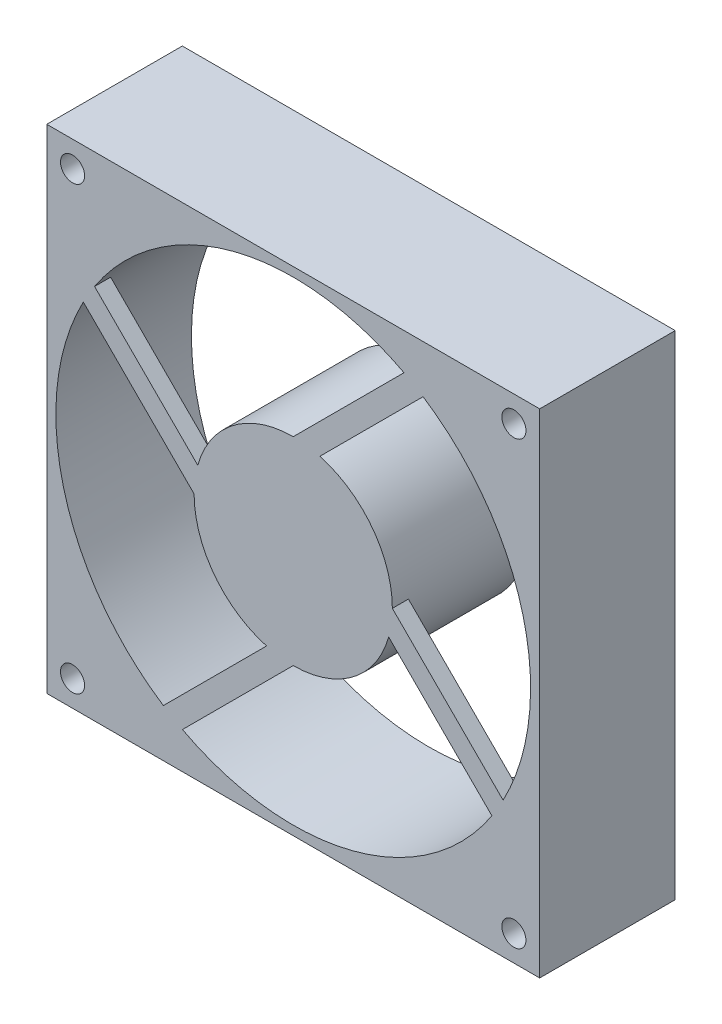
from build123d import *

# Parameters (mm, degrees)
SKETCH1_W             = 92
SKETCH1_H             = 92
SKETCH1_R             = 44.3
SKETCH1_R_2           = 2.25
BOSS_EXTRUDE1_DEPTH   = 12.65
SKETCH1_R_3           = 18.5
BOSS_EXTRUDE1_2_DEPTH = 12.65
BOSS_EXTRUDE2_START   = -3
BOSS_EXTRUDE2_DEPTH   = 3
CIRPATTERN1_COUNT     = 4


with BuildPart() as part:
    # Sketch1 → Boss-Extrude1 (new, symmetric)
    with BuildSketch(Plane.XY):
        Rectangle(SKETCH1_W, SKETCH1_H)
        Circle(SKETCH1_R, mode=Mode.SUBTRACT)
        with Locations((-41.188970004, -41.188970004)):
            Circle(SKETCH1_R_2, mode=Mode.SUBTRACT)
        with Locations((41.188970004, -41.188970004)):
            Circle(SKETCH1_R_2, mode=Mode.SUBTRACT)
        with Locations((41.188970004, 41.188970004)):
            Circle(SKETCH1_R_2, mode=Mode.SUBTRACT)
        with Locations((-41.188970004, 41.188970004)):
            Circle(SKETCH1_R_2, mode=Mode.SUBTRACT)
    extrude(amount=BOSS_EXTRUDE1_DEPTH, both=True)



with BuildPart() as body_2:
    # Sketch1 → Boss-Extrude1 2 (new, symmetric)
    with BuildSketch(Plane.XY):
        Circle(SKETCH1_R_3)
    extrude(amount=BOSS_EXTRUDE1_2_DEPTH, both=True)


with BuildPart() as part_1:
    add(part.part)

    add(body_2.part)  # Boss-Extrude2 merges body 2
    # Sketch2 → Boss-Extrude2 (add)
    with BuildSketch(Plane.XY.offset(12.65).offset(BOSS_EXTRUDE2_START)):
        with BuildLine():
            Line((0, 18.5), (20.677955159, 39.177955159))
            ThreePointArc((20.677955159, 39.177955159), (22.482427755, 38.171068131), (24.237983576, 37.081129327))
            Line((24.237983576, 37.081129327), (4.975286421, 17.818432171))
            ThreePointArc((4.975286421, 17.818432171), (2.510876823, 18.328816044), (0, 18.5))
        make_face()
    boss_extrude2 = extrude(amount=BOSS_EXTRUDE2_DEPTH)

    # CirPattern1: Boss-Extrude2 ×4 about axis
    cirpattern1_axis = Axis((0, 0, 0), (0, 0, 1))
    for i in range(1, CIRPATTERN1_COUNT):
        add(boss_extrude2.rotate(cirpattern1_axis, i * 360 / CIRPATTERN1_COUNT))


solid = part_1.part
